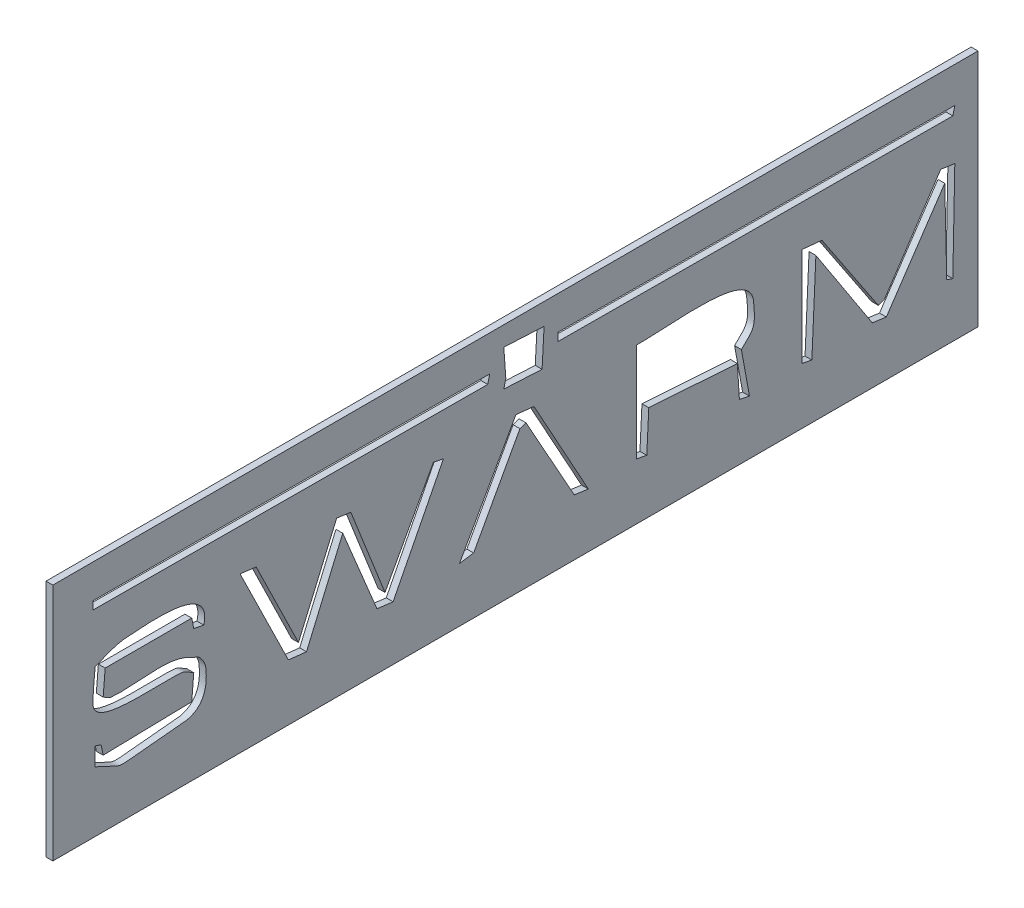
from build123d import *

# Parameters (mm, degrees)
SKETCH1_W           = 430
SKETCH1_H           = 111.062117558
BOSS_EXTRUDE1_DEPTH = 3.175


with BuildPart() as part:
    # Sketch1 → Boss-Extrude1 (new body)
    with BuildSketch(Plane(origin=(0, 0, 0), x_dir=(0, 0, -1), z_dir=(1, 0, 0))):
        with Locations((215, 55.531058779)):
            Rectangle(SKETCH1_W, SKETCH1_H)
        Polygon((209.611812117, 101.998605003), (228.327152485, 101.062837985), (227.391385466, 84.219031654), (209.611812117, 85.154798673), (210.547579135, 88.897866746), align=None, mode=Mode.SUBTRACT)
        Polygon((18.715340368, 95.448235875), (203.061442988, 94.512468856), (202.12567597, 90.769400783), (18.715340368, 91.705167801), align=None, mode=Mode.SUBTRACT)
        Polygon((234.877521613, 95.448235875), (419.223624234, 94.512468856), (418.287857216, 90.769400783), (234.877521613, 91.705167801), align=None, mode=Mode.SUBTRACT)
        with BuildLine():
            Line((70.182526378, 59.889089176), (65.503691287, 60.824856195))
            Line((65.503691287, 60.824856195), (64.567924268, 65.503691287))
            Line((64.567924268, 65.503691287), (24.329942478, 65.503691287))
            Line((24.329942478, 65.503691287), (23.394175459, 54.274487066))
            add(Edge.make_bspline(
                [(23.394175459, 54.274487066), (24.641864817, 53.650642387), (25.748281051, 52.532158841), (27.137243533, 52.402953029), (39.595393057, 51.244055399), (53.839027976, 56.032989749), (64.567924268, 49.595651974), (65.764091836, 48.877951433), (67.39240534, 48.773931653), (68.310992342, 47.724117937), (69.688872844, 46.149397364), (70.887222202, 44.189156581), (71.118293397, 42.109515827), (72.101578234, 33.259952297), (69.581527607, 25.974912308), (59.889089176, 25.265709496), (22.729411632, 22.5467087), (37.078345638, 20.604194158), (19.651107386, 28.073010551)],
                knots=[0, 0, 0, 0, 1, 1, 1, 2, 2, 2, 3, 3, 3, 4, 4, 4, 5, 5, 5, 6, 6, 6, 6], degree=3))
            Line((19.651107386, 28.073010551), (19.651107386, 36.494913717))
            Line((19.651107386, 36.494913717), (22.458408441, 35.559146698))
            Line((22.458408441, 35.559146698), (23.394175459, 30.880311607))
            Line((23.394175459, 30.880311607), (64.567924268, 31.816078625))
            Line((64.567924268, 31.816078625), (65.503691287, 43.045282845))
            add(Edge.make_bspline(
                [(65.503691287, 43.045282845), (63.63215725, 43.981049864), (61.968147228, 45.616327304), (59.889089176, 45.852583901), (49.377809759, 47.047047471), (19.236306893, 42.919389546), (18.715340368, 53.338720048), (18.465627539, 58.332976628), (19.339185047, 63.32023491), (19.651107386, 68.310992342)],
                knots=[0, 0, 0, 0, 1, 1, 1, 2, 2, 2, 3, 3, 3, 3], degree=3))
            add(Edge.make_bspline(
                [(19.651107386, 68.310992342), (24.731477432, 70.48829379), (30.033684854, 72.848148925), (35.559146698, 72.989827434), (41.574454702, 73.1440661), (74.601628044, 77.565495837), (70.182526378, 59.889089176)],
                knots=[0, 0, 0, 0, 1, 1, 1, 2, 2, 2, 2], degree=3))
        make_face(mode=Mode.SUBTRACT)
        Polygon((87.026332709, 72.054060415), (94.512468856, 71.118293397), (114.163576242, 30.880311607), (131.943149592, 72.054060415), (138.49351872, 71.118293397), (154.401558033, 30.880311607), (176.859966474, 72.054060415), (181.538801566, 71.118293397), (158.144626106, 25.265709496), (150.658489959, 26.201476515), (134.750450647, 64.567924268), (117.906644316, 25.265709496), (109.48474115, 26.201476515), align=None, mode=Mode.SUBTRACT)
        Polygon((215.226414227, 72.054060415), (223.648317393, 71.118293397), (248.914026889, 25.265709496), (242.36365776, 26.201476515), (219.905249319, 66.439458305), (217.097948264, 65.503691287), (195.575306841, 26.201476515), (189.024937713, 25.265709496), align=None, mode=Mode.SUBTRACT)
        with BuildLine():
            Line((320.032320286, 45.852583901), (323.775388359, 25.265709496))
            Line((323.775388359, 25.265709496), (319.096553267, 26.201476515))
            Line((319.096553267, 26.201476515), (318.160786249, 41.173748809))
            Line((318.160786249, 41.173748809), (276.98703744, 43.981049864))
            Line((276.98703744, 43.981049864), (276.051270422, 25.265709496))
            Line((276.051270422, 25.265709496), (271.37243533, 26.201476515))
            Line((271.37243533, 26.201476515), (271.37243533, 72.054060415))
            add(Edge.make_bspline(
                [(271.37243533, 72.054060415), (287.506192288, 71.724800069), (324.056750843, 77.803019989), (325.646922396, 62.696390231), (326.851803922, 51.25001574), (325.818749624, 51.639013239), (320.032320286, 45.852583901)],
                knots=[0, 0, 0, 0, 1, 1, 1, 2, 2, 2, 2], degree=3))
        make_face(mode=Mode.SUBTRACT)
        Polygon((348.105330837, 72.054060415), (357.463001021, 71.118293397), (383.664477536, 31.816078625), (386.471778591, 32.751845643), (412.673255105, 72.054060415), (419.223624234, 71.118293397), (418.287857216, 25.265709496), (415.480556161, 26.201476515), (414.544789142, 65.503691287), (387.407545609, 25.265709496), (380.857176481, 26.201476515), (354.655699966, 66.439458305), (352.784165929, 25.265709496), (348.105330837, 26.201476515), align=None, mode=Mode.SUBTRACT)
    extrude(amount=BOSS_EXTRUDE1_DEPTH)


solid = part.part
